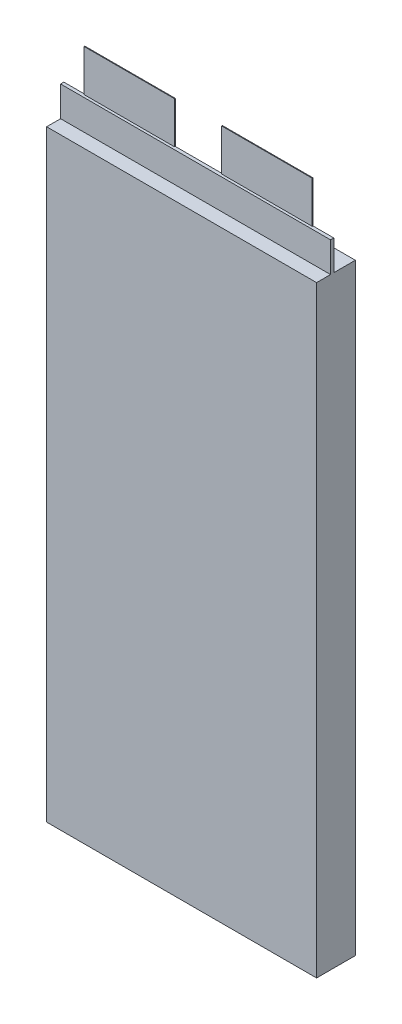
from build123d import *

# Parameters (mm, degrees)
SKETCH1_W           = 74.5
SKETCH1_H           = 166.2
BOSS_EXTRUDE1_DEPTH = 10.7
SKETCH2_W           = 74.5
SKETCH2_H           = 8.3
BOSS_EXTRUDE2_DEPTH = 0.9
SKETCH3_W           = 25
SKETCH3_H           = 11.5
BOSS_EXTRUDE3_DEPTH = 0.2
SKETCH3_3_W         = 25
SKETCH3_3_H         = 11.5
BOSS_EXTRUDE4_DEPTH = 0.2


with BuildPart() as part:
    # Sketch1 → Boss-Extrude1 (new body)
    with BuildSketch(Plane.XY):
        with Locations((0, 83.1)):
            Rectangle(SKETCH1_W, SKETCH1_H)
    extrude(amount=BOSS_EXTRUDE1_DEPTH)

    # Sketch2 → Boss-Extrude2 (add)
    with BuildSketch(Plane.XY.offset(5.95)):
        with Locations((0, 170.35)):
            Rectangle(SKETCH2_W, SKETCH2_H)
    extrude(amount=BOSS_EXTRUDE2_DEPTH)


with BuildPart() as body_2:
    # Sketch3 → Boss-Extrude3 (new body)
    with BuildSketch(Plane.XY.offset(5.95)):
        with Locations((-19, 180.25)):
            Rectangle(SKETCH3_W, SKETCH3_H)
    extrude(amount=BOSS_EXTRUDE3_DEPTH)


with BuildPart() as body_3:
    # Sketch3<3> → Boss-Extrude4 (new body)
    with BuildSketch(Plane.XY.offset(5.95)):
        with Locations((19, 180.25)):
            Rectangle(SKETCH3_3_W, SKETCH3_3_H)
    extrude(amount=BOSS_EXTRUDE4_DEPTH)


solid = Compound([part.part, body_2.part, body_3.part])
